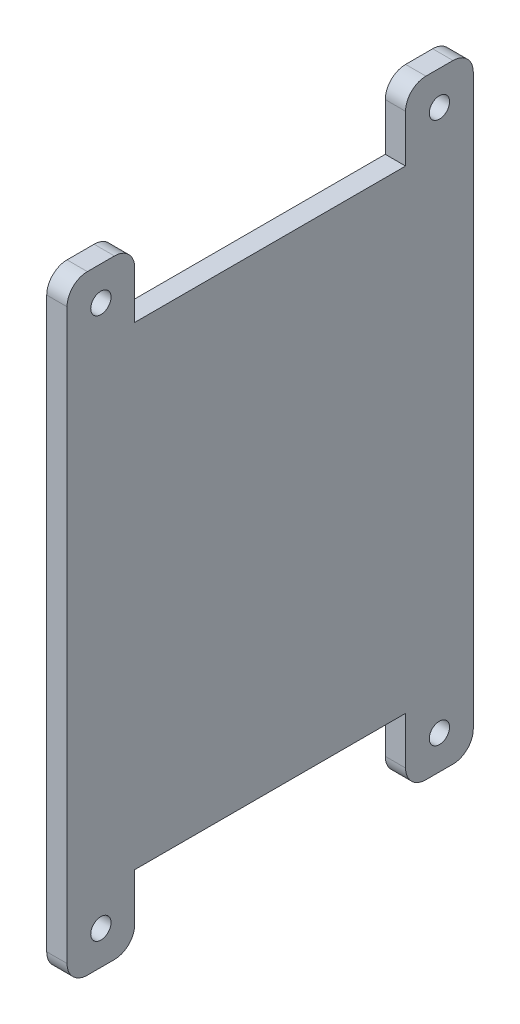
from build123d import *

# Parameters (mm, degrees)
PCB_DEPTH       = 3
ESBO_O4_R       = 1.5
FUROS_PCB_DEPTH = 75.972458232


with BuildPart() as part:
    # Esboço3 → PCB (new body)
    with BuildSketch(Plane(origin=(0, 0, 0), x_dir=(0, 0, -1), z_dir=(1, 0, 0))):
        with BuildLine():
            Line((-1.863527408, 22.600091465), (38.136472592, 22.600091465))
            Line((38.136472592, 22.600091465), (38.136472592, 29.600091465))
            ThreePointArc((38.136472592, 29.600091465), (39.015152248, 31.721411809), (41.136472592, 32.600091465))
            Line((41.136472592, 32.600091465), (45.136472592, 32.600091465))
            ThreePointArc((45.136472592, 32.600091465), (47.257792935, 31.721411809), (48.136472592, 29.600091465))
            Line((48.136472592, 29.600091465), (48.136472592, 22.600091465))
            Line((48.136472592, 22.600091465), (48.136472592, -47.399908535))
            Line((48.136472592, -47.399908535), (48.136472592, -54.399908535))
            ThreePointArc((48.136472592, -54.399908535), (47.257792935, -56.521228878), (45.136472592, -57.399908535))
            Line((45.136472592, -57.399908535), (41.136472592, -57.399908535))
            ThreePointArc((41.136472592, -57.399908535), (39.015152248, -56.521228878), (38.136472592, -54.399908535))
            Line((38.136472592, -54.399908535), (38.136472592, -47.399908535))
            Line((38.136472592, -47.399908535), (-1.863527408, -47.399908535))
            Line((-1.863527408, -47.399908535), (-1.863527408, -54.399908535))
            ThreePointArc((-1.863527408, -54.399908535), (-2.742207065, -56.521228878), (-4.863527408, -57.399908535))
            Line((-4.863527408, -57.399908535), (-8.863527408, -57.399908535))
            ThreePointArc((-8.863527408, -57.399908535), (-10.984847752, -56.521228878), (-11.863527408, -54.399908535))
            Line((-11.863527408, -54.399908535), (-11.863527408, -47.399908535))
            Line((-11.863527408, -47.399908535), (-11.863527408, 22.600091465))
            Line((-11.863527408, 22.600091465), (-11.863527408, 29.600091465))
            ThreePointArc((-11.863527408, 29.600091465), (-10.984847752, 31.721411809), (-8.863527408, 32.600091465))
            Line((-8.863527408, 32.600091465), (-4.863527408, 32.600091465))
            ThreePointArc((-4.863527408, 32.600091465), (-2.742207065, 31.721411809), (-1.863527408, 29.600091465))
            Line((-1.863527408, 29.600091465), (-1.863527408, 22.600091465))
        make_face()
    extrude(amount=PCB_DEPTH)

    # Esboço4 → Furos PCB (cut, through all)
    with BuildSketch(Plane.ZY):
        with Locations((-43.136472592, 27.600091465)):
            Circle(ESBO_O4_R)
        with Locations((6.863527408, 27.600091465)):
            Circle(ESBO_O4_R)
        with Locations((6.863527408, -52.399908535)):
            Circle(ESBO_O4_R)
        with Locations((-43.136472592, -52.399908535)):
            Circle(ESBO_O4_R)
    extrude(amount=-FUROS_PCB_DEPTH, mode=Mode.SUBTRACT)


solid = part.part
